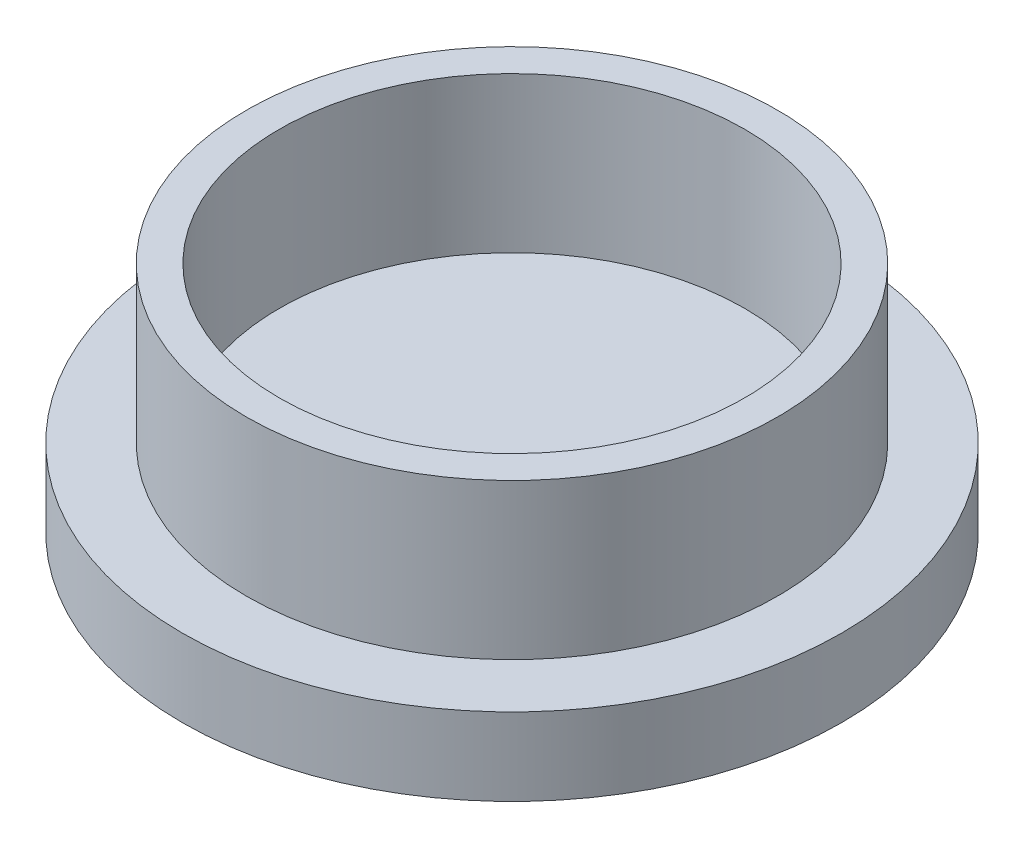
from build123d import *

# Parameters (mm, degrees)
SKETCH1_R           = 3.425
BOSS_EXTRUDE1_DEPTH = 2
SKETCH2_R           = 4.25
BOSS_EXTRUDE2_DEPTH = 1
SKETCH3_R           = 3
CUT_EXTRUDE1_DEPTH  = 2


with BuildPart() as part:
    # Sketch1 → Boss-Extrude1 (new body)
    with BuildSketch(Plane(origin=(0, 0, 0), x_dir=(1, 0, 0), z_dir=(0, 1, 0))):
        with Locations(Location((0, 0, 0), (0, 0, 270))):
            Circle(SKETCH1_R)
    extrude(amount=BOSS_EXTRUDE1_DEPTH)

    # Sketch2 → Boss-Extrude2 (add)
    with BuildSketch(Plane.XZ):
        with Locations(Location((0, 0, 0), (0, 0, 270))):
            Circle(SKETCH2_R)
    extrude(amount=BOSS_EXTRUDE2_DEPTH)

    # Sketch3 → Cut-Extrude1 (cut)
    with BuildSketch(Plane(origin=(0, 2, 0), x_dir=(1, 0, 0), z_dir=(0, 1, 0))):
        with Locations(Location((0, 0, 0), (0, 0, 270))):
            Circle(SKETCH3_R)
    extrude(amount=-CUT_EXTRUDE1_DEPTH, mode=Mode.SUBTRACT)


solid = part.part
